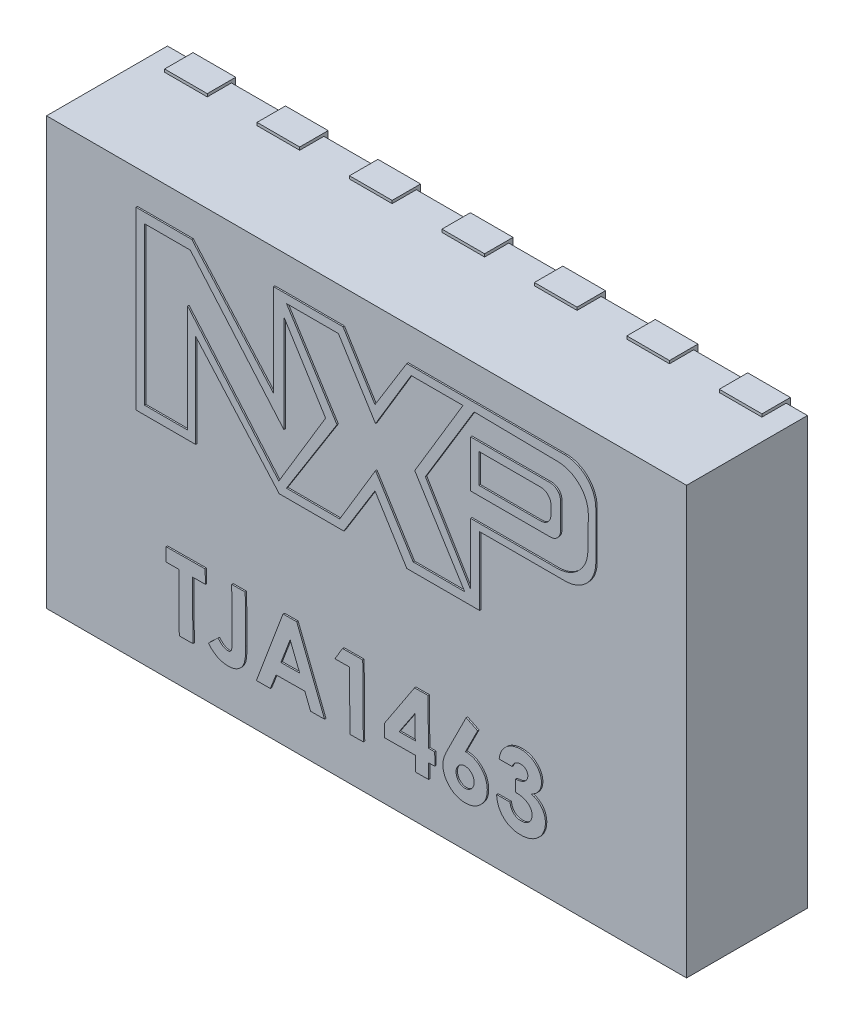
from build123d import *

# Parameters (mm, degrees)
SKETCH1_W           = 4.5
SKETCH1_H           = 3
BOSS_EXTRUDE1_DEPTH = 0.85
SKETCH2_W           = 4.2
SKETCH2_H           = 1.6
SKETCH2_W_2         = 0.3
SKETCH2_H_2         = 0.557287179
BOSS_EXTRUDE2_DEPTH = 0.03
SKETCH3_W           = 5.542428218
SKETCH3_H           = 0.402549931
SKETCH3_W_2         = 5.108551145
SKETCH3_H_2         = 0.537427481
CUT_EXTRUDE1_DEPTH  = 2.03
SKETCH4_W           = 0.3
SKETCH4_H           = 0.2
BOSS_EXTRUDE3_DEPTH = 0.02
BOSS_EXTRUDE4_DEPTH = 0.01
BOSS_EXTRUDE5_DEPTH = 0.01


with BuildPart() as part:
    # Sketch1 → Boss-Extrude1 (new body)
    with BuildSketch(Plane.XY):
        Rectangle(SKETCH1_W, SKETCH1_H)
    extrude(amount=BOSS_EXTRUDE1_DEPTH)

    # Sketch2 → Boss-Extrude2 (add)
    with BuildSketch(Plane(origin=(0, 0, 0), x_dir=(-1, 0, 0), z_dir=(0, 0, -1))):
        Rectangle(SKETCH2_W, SKETCH2_H)
        with Locations((-1.95, 1.37864359)):
            Rectangle(SKETCH2_W_2, SKETCH2_H_2)
        with Locations((-1.3, 1.37864359)):
            Rectangle(SKETCH2_W_2, SKETCH2_H_2)
        with Locations((-0.65, 1.37864359)):
            Rectangle(SKETCH2_W_2, SKETCH2_H_2)
        with Locations((0, 1.37864359)):
            Rectangle(SKETCH2_W_2, SKETCH2_H_2)
        with Locations((0.65, 1.37864359)):
            Rectangle(SKETCH2_W_2, SKETCH2_H_2)
        with Locations((1.3, 1.37864359)):
            Rectangle(SKETCH2_W_2, SKETCH2_H_2)
        with Locations((1.95, 1.37864359)):
            Rectangle(SKETCH2_W_2, SKETCH2_H_2)
        with Locations((1.95, -1.37864359)):
            Rectangle(SKETCH2_W_2, SKETCH2_H_2)
        with Locations((1.3, -1.37864359)):
            Rectangle(SKETCH2_W_2, SKETCH2_H_2)
        with Locations((0.65, -1.37864359)):
            Rectangle(SKETCH2_W_2, SKETCH2_H_2)
        with Locations((0, -1.37864359)):
            Rectangle(SKETCH2_W_2, SKETCH2_H_2)
        with Locations((-0.65, -1.37864359)):
            Rectangle(SKETCH2_W_2, SKETCH2_H_2)
        with Locations((-1.3, -1.37864359)):
            Rectangle(SKETCH2_W_2, SKETCH2_H_2)
        with Locations((-1.95, -1.37864359)):
            Rectangle(SKETCH2_W_2, SKETCH2_H_2)
    extrude(amount=BOSS_EXTRUDE2_DEPTH)

    # Sketch3 → Cut-Extrude1 (cut)
    with BuildSketch(Plane.XY.offset(0.85)):
        with Locations((0.521214109, 1.701274966)):
            Rectangle(SKETCH3_W, SKETCH3_H)
        with Locations((0.304275573, -1.76871374)):
            Rectangle(SKETCH3_W_2, SKETCH3_H_2)
    extrude(amount=-CUT_EXTRUDE1_DEPTH, mode=Mode.SUBTRACT)

    # Sketch4 → Boss-Extrude3 (add)
    with BuildSketch(Plane.XZ.offset(1.5)):
        with Locations((-1.95, 0.07)):
            Rectangle(SKETCH4_W, SKETCH4_H)
        with Locations((-1.3, 0.07)):
            Rectangle(SKETCH4_W, SKETCH4_H)
        with Locations((-0.65, 0.07)):
            Rectangle(SKETCH4_W, SKETCH4_H)
        with Locations((0, 0.07)):
            Rectangle(SKETCH4_W, SKETCH4_H)
        with Locations((0.65, 0.07)):
            Rectangle(SKETCH4_W, SKETCH4_H)
        with Locations((1.3, 0.07)):
            Rectangle(SKETCH4_W, SKETCH4_H)
        with Locations((1.95, 0.07)):
            Rectangle(SKETCH4_W, SKETCH4_H)
    boss_extrude3 = extrude(amount=BOSS_EXTRUDE3_DEPTH)

    # Mirror1: Boss-Extrude3 across plane
    add(boss_extrude3.mirror(Plane.ZX))

    # Sketch8 → Boss-Extrude4 (add)
    # profile 1 of 2: a face of its own
    with BuildSketch(Plane.XY.offset(0.85)):
        with BuildLine():
            Line((-1.218559147, 1.267877009), (-0.644660909, 0.618874845))
            Line((-0.644660909, 0.618874845), (-0.644660909, 1.267877009))
            Line((-0.644660909, 1.267877009), (-0.155544183, 1.267877009))
            Line((-0.155544183, 1.267877009), (0.069183646, 0.905578427))
            Line((0.069183646, 0.905578427), (0.292952543, 1.267877009))
            Line((0.292952543, 1.267877009), (1.405698433, 1.267877009))
            ThreePointArc((1.405698433, 1.267877009), (1.558433498, 1.204612074), (1.621698433, 1.051877009))
            Line((1.621698433, 1.051877009), (1.621698433, 0.716280897))
            ThreePointArc((1.621698433, 0.716280897), (1.558433498, 0.563545832), (1.405698433, 0.500280897))
            Line((1.405698433, 0.500280897), (0.805434822, 0.500280897))
            Line((0.805434822, 0.500280897), (0.805434822, 0.020247185))
            Line((0.805434822, 0.020247185), (0.292952543, 0.020247185))
            Line((0.292952543, 0.020247185), (0.069183646, 0.38099981))
            Line((0.069183646, 0.38099981), (-0.149697341, 0.02661512))
            Line((-0.149697341, 0.02661512), (-0.603870765, 0.02661512))
            Line((-0.603870765, 0.02661512), (-1.192061741, 0.691780461))
            Line((-1.192061741, 0.691780461), (-1.192061741, 0.032897543))
            Line((-1.192061741, 0.032897543), (-1.611137286, 0.032897543))
            Line((-1.611137286, 0.032897543), (-1.611137286, 1.267877009))
            Line((-1.611137286, 1.267877009), (-1.218559147, 1.267877009))
        make_face()
        Polygon((-0.553231932, 1.210312598), (-0.188037013, 1.210312598), (0.073077476, 0.79234991), (0.323648792, 1.210312598), (0.688184293, 1.210312598), (0.348798025, 0.644203119), (0.699760653, 0.08242164), (0.337615575, 0.08242164), (0.073077476, 0.505864459), (-0.178605926, 0.086046767), (-0.553231932, 0.086046767), (-0.198118064, 0.650042618), align=None, mode=Mode.SUBTRACT)
        with BuildLine():
            Line((0.766182701, 1.210312598), (1.356373147, 1.202040737))
            ThreePointArc((1.356373147, 1.202040737), (1.508206605, 1.136641555), (1.569324867, 0.983034882))
            Line((1.569324867, 0.983034882), (1.566236946, 0.762714247))
            ThreePointArc((1.566236946, 0.762714247), (1.501919217, 0.611939743), (1.350258158, 0.549741315))
            Line((1.350258158, 0.549741315), (0.741987684, 0.549741315))
            Line((0.741987684, 0.549741315), (0.741987684, 0.115644305))
            Line((0.741987684, 0.115644305), (0.423296465, 0.644203119))
            Line((0.423296465, 0.644203119), (0.766182701, 1.210312598))
        make_face(mode=Mode.SUBTRACT)
        Polygon((-1.552044791, 0.09243378), (-1.552044791, 1.197500136), (-1.229122452, 1.197500136), (-0.571417002, 0.433439095), (-0.571417002, 1.120265885), (-0.27795521, 0.650042618), (-0.606889936, 0.102651869), (-1.247993344, 0.847426201), (-1.247993344, 0.09243378), align=None, mode=Mode.SUBTRACT)
    # profile 2 of 2: a face of its own
    with BuildSketch(Plane.XY.offset(0.85)):
        with BuildLine():
            Line((0.741987684, 1.046016424), (0.741987684, 0.716280897))
            Line((0.741987684, 0.716280897), (1.301592263, 0.716280897))
            ThreePointArc((1.301592263, 0.716280897), (1.352503951, 0.737369209), (1.373592263, 0.788280897))
            Line((1.373592263, 0.788280897), (1.373592263, 0.974016424))
            ThreePointArc((1.373592263, 0.974016424), (1.352503951, 1.024928112), (1.301592263, 1.046016424))
            Line((1.301592263, 1.046016424), (0.741987684, 1.046016424))
        make_face()
        with BuildLine():
            Line((0.79982972, 0.986259174), (1.234333614, 0.986259174))
            ThreePointArc((1.234333614, 0.986259174), (1.285245302, 0.965170862), (1.306333614, 0.914259174))
            Line((1.306333614, 0.914259174), (1.306333614, 0.851953508))
            ThreePointArc((1.306333614, 0.851953508), (1.285245302, 0.801041819), (1.234333614, 0.779953508))
            Line((1.234333614, 0.779953508), (0.79982972, 0.779953508))
            Line((0.79982972, 0.779953508), (0.79982972, 0.986259174))
        make_face(mode=Mode.SUBTRACT)
    extrude(amount=BOSS_EXTRUDE4_DEPTH)

    # Sketch9 → Boss-Extrude5 (add)
    # profile 1 of 7: a face of its own
    with BuildSketch(Plane.XY.offset(0.85)):
        Polygon((-1.399310853, -0.693693246), (-1.12447111, -0.6912894), (-1.123669828, -0.784638759), (-1.21431486, -0.785440041), (-1.210809251, -1.189386355), (-1.306762776, -1.190287797), (-1.310268385, -0.786341483), (-1.398509571, -0.787042605), align=None)
    # profile 2 of 7: a face of its own
    with BuildSketch(Plane.XY.offset(0.85)):
        with BuildLine():
            Line((-0.938173033, -0.692190842), (-0.843120949, -0.69138956))
            Line((-0.843120949, -0.69138956), (-0.840316462, -1.021317445))
            add(Edge.make_bspline(
                [(-0.840316462, -1.021317445), (-0.840273953, -1.027627977), (-0.840192068, -1.039783978), (-0.840755581, -1.057281917), (-0.841514224, -1.073348022), (-0.842639035, -1.087961486), (-0.844398527, -1.101077384), (-0.846277527, -1.112749454), (-0.848824076, -1.122899753), (-0.852446809, -1.134451439), (-0.858522434, -1.147232389), (-0.867822869, -1.160911403), (-0.879203996, -1.172993591), (-0.892553585, -1.183292732), (-0.90763241, -1.191654606), (-0.924294633, -1.197679182), (-0.942380937, -1.201453536), (-0.954947749, -1.202017177), (-0.961410212, -1.202307028)],
                knots=[0, 0, 0, 0, 1.209486598, 2.329838602, 3.355021681, 4.292484636, 5.137835443, 5.89111849, 6.556963681, 7.141835232, 8.209634135, 9.255089287, 10.300857766, 11.377365432, 12.474428666, 13.591962539, 14.76167063, 16, 16, 16, 16], degree=3))
            add(Edge.make_bspline(
                [(-0.961410212, -1.202307028), (-0.968167571, -1.20213582), (-0.981494318, -1.201798165), (-1.001062768, -1.198476951), (-1.019877812, -1.19306941), (-1.037937777, -1.185275241), (-1.055236031, -1.175151738), (-1.071843008, -1.162854549), (-1.087659356, -1.148271191), (-1.097170126, -1.137171567), (-1.102035212, -1.131493727)],
                knots=[0, 0, 0, 0, 0.993177984, 1.958728763, 2.9098356, 3.866731057, 4.843752359, 5.851453285, 6.900944283, 8, 8, 8, 8], degree=3))
            Line((-1.102035212, -1.131493727), (-1.034326879, -1.066990522))
            add(Edge.make_bspline(
                [(-1.034326879, -1.066990522), (-1.030704174, -1.070945123), (-1.023921627, -1.078349057), (-1.013745732, -1.087952349), (-1.004489419, -1.095539532), (-0.995916998, -1.101113574), (-0.98779128, -1.105065602), (-0.97992251, -1.107630203), (-0.97223842, -1.109387369), (-0.967128511, -1.109569309), (-0.96461534, -1.109658791)],
                knots=[0, 0, 0, 0, 1.527052862, 2.858997954, 3.981709547, 4.931281668, 5.764883684, 6.54670979, 7.285238677, 8, 8, 8, 8], degree=3))
            add(Edge.make_bspline(
                [(-0.96461534, -1.109658791), (-0.962222867, -1.109480914), (-0.957639051, -1.109140113), (-0.951201076, -1.10663254), (-0.945892494, -1.102379402), (-0.942380781, -1.097561474), (-0.94018869, -1.092695302), (-0.938718808, -1.08798944), (-0.937567543, -1.082312072), (-0.936558159, -1.07573021), (-0.935908, -1.068167817), (-0.935418298, -1.059651136), (-0.935095672, -1.050165867), (-0.935143326, -1.043519871), (-0.935168225, -1.040047413)],
                knots=[0, 0, 0, 0, 1.014740194, 1.944172476, 2.883073635, 3.867137759, 4.444472031, 5.143984344, 5.956014201, 6.902485976, 7.970506852, 9.177775936, 10.525419741, 12, 12, 12, 12], degree=3))
            Line((-0.935168225, -1.040047413), (-0.938173033, -0.692190842))
        make_face()
    # profile 3 of 7: a face of its own
    with BuildSketch(Plane.XY.offset(0.85)):
        Polygon((-0.577095308, -0.691990522), (-0.481041622, -0.69118924), (-0.285428642, -1.186782188), (-0.383786013, -1.187683631), (-0.423549635, -1.085520169), (-0.626374154, -1.087323054), (-0.666037616, -1.190087477), (-0.764495148, -1.190988919), align=None)
        Polygon((-0.527315661, -0.823500938), (-0.592019186, -0.994674817), (-0.459907808, -0.993573054), align=None, mode=Mode.SUBTRACT)
    # profile 4 of 7: a face of its own
    with BuildSketch(Plane.XY.offset(0.85)):
        Polygon((-0.158625757, -0.692791804), (-0.016898994, -0.691589881), (-0.012592103, -1.188885554), (-0.106642584, -1.189686836), (-0.110148193, -0.78133347), (-0.212511975, -0.782234913), align=None)
    # profile 5 of 7: a face of its own
    with BuildSketch(Plane.XY.offset(0.85)):
        Polygon((0.347584179, -0.679270169), (0.442235621, -0.678468887), (0.445040108, -0.998681227), (0.489310942, -0.998280586), (0.490012064, -1.08582065), (0.44574123, -1.086221291), (0.446642672, -1.188284592), (0.354094596, -1.189085874), (0.353193153, -1.087022573), (0.136145878, -1.088925618), (0.135444756, -1.001385554), align=None)
        Polygon((0.352492031, -0.999482509), (0.350989628, -0.832815842), (0.238910301, -1.000484111), align=None, mode=Mode.SUBTRACT)
    # profile 6 of 7: a face of its own
    with BuildSketch(Plane.XY.offset(0.85)):
        with BuildLine():
            Line((0.710264467, -0.67957065), (0.790993634, -0.719133951))
            Line((0.790993634, -0.719133951), (0.705657096, -0.888905586))
            add(Edge.make_bspline(
                [(0.705657096, -0.888905586), (0.710838518, -0.889002913), (0.721041701, -0.889194569), (0.736043161, -0.891253127), (0.750463539, -0.894678812), (0.764345482, -0.899431854), (0.777523934, -0.905880989), (0.79025619, -0.913503219), (0.802375614, -0.922635188), (0.813684454, -0.933155403), (0.824212425, -0.944539587), (0.833302127, -0.956909204), (0.841142091, -0.96991547), (0.847392683, -0.983698635), (0.852498906, -0.998120488), (0.856040073, -1.013269937), (0.858328346, -1.029127806), (0.858642049, -1.039939174), (0.858802128, -1.045456067)],
                knots=[0, 0, 0, 0, 1.018137654, 2.004902093, 2.969678775, 3.928700089, 4.882812206, 5.848637716, 6.842384913, 7.859675917, 8.881804503, 9.886074225, 10.872161699, 11.861912345, 12.856244641, 13.875143678, 14.915714941, 16, 16, 16, 16], degree=3))
            add(Edge.make_bspline(
                [(0.858802128, -1.045456067), (0.858706064, -1.050771374), (0.858516841, -1.061241256), (0.856438786, -1.07663394), (0.853091125, -1.091459848), (0.848089281, -1.105608933), (0.841928758, -1.119236749), (0.834091323, -1.13215565), (0.824839842, -1.144444716), (0.814433364, -1.156094661), (0.80293739, -1.166661487), (0.790763355, -1.176000699), (0.777889864, -1.183883776), (0.764495035, -1.190421416), (0.750447684, -1.195463538), (0.735807554, -1.199032117), (0.720593094, -1.201447698), (0.710207021, -1.201752356), (0.704955974, -1.201906387)],
                knots=[0, 0, 0, 0, 1.044161297, 2.056747599, 3.046884618, 4.026461564, 5.00134524, 5.981603371, 6.989586016, 8.021237463, 9.047594761, 10.054294876, 11.032353933, 12.009708241, 12.979098821, 13.959532665, 14.968369424, 16, 16, 16, 16], degree=3))
            add(Edge.make_bspline(
                [(0.704955974, -1.201906387), (0.69944102, -1.201810032), (0.688639592, -1.201621313), (0.672765283, -1.199572225), (0.657587948, -1.196086315), (0.643072982, -1.191061216), (0.629301491, -1.184492183), (0.616179498, -1.176550387), (0.603836602, -1.167061667), (0.59230991, -1.156290681), (0.581781349, -1.144594032), (0.572551359, -1.132244611), (0.564644984, -1.119514545), (0.558352715, -1.106230274), (0.553145619, -1.092640683), (0.549586956, -1.078517196), (0.54728771, -1.063993757), (0.546965812, -1.054145367), (0.546802929, -1.049161996)],
                knots=[0, 0, 0, 0, 1.083045268, 2.121221099, 3.13797642, 4.137876037, 5.13255511, 6.130408597, 7.14587237, 8.185518485, 9.225992015, 10.233543626, 11.211184445, 12.164694915, 13.117460517, 14.065676557, 15.021215536, 16, 16, 16, 16], degree=3))
            add(Edge.make_bspline(
                [(0.546802929, -1.049161996), (0.546841765, -1.045319736), (0.546919972, -1.037582449), (0.548163637, -1.025958919), (0.550316032, -1.014330893), (0.552687604, -1.004497578), (0.555384533, -0.996276354), (0.557909246, -0.989271143), (0.560870577, -0.981409703), (0.564683201, -0.972881107), (0.568672811, -0.96340132), (0.573615534, -0.953309392), (0.578840388, -0.942318639), (0.582613463, -0.934772496), (0.584563346, -0.930872733)],
                knots=[0, 0, 0, 0, 1.101863569, 2.218859815, 3.347986803, 4.493248451, 5.117227413, 5.829175619, 6.629625924, 7.526348739, 8.508612668, 9.579698087, 10.749215026, 12, 12, 12, 12], degree=3))
            Line((0.584563346, -0.930872733), (0.710264467, -0.67957065))
        make_face()
        with BuildLine():
            add(Edge.make_bspline(
                [(0.701049724, -0.978549015), (0.696782772, -0.978804739), (0.688488198, -0.979301843), (0.676587966, -0.983052588), (0.665922789, -0.989323717), (0.656539802, -0.997746425), (0.648826037, -1.007941571), (0.643234858, -1.019541929), (0.639923472, -1.0323866), (0.639612222, -1.041329423), (0.639451166, -1.045956868)],
                knots=[0, 0, 0, 0, 1.003811643, 1.951320622, 2.906142115, 3.897371915, 4.902260824, 5.897505543, 6.912068843, 8, 8, 8, 8], degree=3))
            add(Edge.make_bspline(
                [(0.639451166, -1.045956868), (0.639704704, -1.050590486), (0.640197934, -1.059604698), (0.643959057, -1.072498834), (0.649930544, -1.084232226), (0.658166974, -1.09444572), (0.667829549, -1.102950382), (0.678673067, -1.109087067), (0.690311378, -1.112921375), (0.69838334, -1.113282738), (0.702451967, -1.113464881)],
                knots=[0, 0, 0, 0, 1.083811192, 2.108439807, 3.119070023, 4.14849075, 5.162834589, 6.115223768, 7.049988985, 8, 8, 8, 8], degree=3))
            add(Edge.make_bspline(
                [(0.702451967, -1.113464881), (0.706725206, -1.113225762), (0.715116123, -1.112756231), (0.727086186, -1.10868428), (0.738122405, -1.102506807), (0.747839204, -1.093942539), (0.7560893, -1.083709723), (0.762110303, -1.071897234), (0.765596337, -1.058740706), (0.765964016, -1.049583831), (0.76615389, -1.044855105)],
                knots=[0, 0, 0, 0, 0.981926849, 1.928108441, 2.88213558, 3.879930144, 4.892555615, 5.893546729, 6.912200913, 8, 8, 8, 8], degree=3))
            add(Edge.make_bspline(
                [(0.76615389, -1.044855105), (0.765896402, -1.04025561), (0.765393725, -1.031276324), (0.761688941, -1.018510116), (0.75575352, -1.006925339), (0.747518773, -0.996973467), (0.737804962, -0.988521271), (0.726490718, -0.982680299), (0.71413894, -0.978953667), (0.705484464, -0.978686115), (0.701049724, -0.978549015)],
                knots=[0, 0, 0, 0, 1.062668883, 2.074577623, 3.048532191, 4.053136985, 5.044837952, 6.005104562, 6.977772572, 8, 8, 8, 8], degree=3))
        make_face(mode=Mode.SUBTRACT)
    # profile 7 of 7: a face of its own
    with BuildSketch(Plane.XY.offset(0.85)):
        with BuildLine():
            Line((1.033181134, -0.815387958), (0.942235621, -0.816089079))
            add(Edge.make_bspline(
                [(0.942235621, -0.816089079), (0.942828484, -0.811601939), (0.943995656, -0.802768094), (0.946997844, -0.78998131), (0.950511523, -0.777777247), (0.95508112, -0.766361763), (0.960296177, -0.755560166), (0.966291683, -0.745391342), (0.973239374, -0.73595286), (0.978414001, -0.73014616), (0.98099764, -0.727246932)],
                knots=[0, 0, 0, 0, 1.100540977, 2.166638191, 3.192102334, 4.187660448, 5.154026013, 6.10829865, 7.055492222, 8, 8, 8, 8], degree=3))
            add(Edge.make_bspline(
                [(0.98099764, -0.727246932), (0.984799095, -0.723495465), (0.992310844, -0.716082494), (1.004706966, -0.706447902), (1.017833823, -0.698266396), (1.031712793, -0.69149293), (1.046389481, -0.686338452), (1.061733193, -0.682472201), (1.077850307, -0.680157083), (1.088862843, -0.679768716), (1.094479211, -0.67957065)],
                knots=[0, 0, 0, 0, 1.011776976, 1.999290932, 2.968710122, 3.939615709, 4.920515979, 5.912138565, 6.935195367, 8, 8, 8, 8], degree=3))
            add(Edge.make_bspline(
                [(1.094479211, -0.67957065), (1.09949232, -0.679647089), (1.109315575, -0.679796872), (1.123762154, -0.681560724), (1.137609209, -0.68444756), (1.150894538, -0.688518786), (1.163486453, -0.693994537), (1.1754749, -0.700664166), (1.186917819, -0.708458905), (1.197572302, -0.71746915), (1.207275833, -0.727271557), (1.215885725, -0.737623414), (1.223115363, -0.748478998), (1.229094746, -0.759772999), (1.233744047, -0.771564695), (1.236988371, -0.783840373), (1.239238071, -0.796543221), (1.239485872, -0.805195101), (1.239611422, -0.809578663)],
                knots=[0, 0, 0, 0, 1.109786789, 2.174642061, 3.217367451, 4.239437523, 5.24630828, 6.252527165, 7.273928299, 8.307806609, 9.337870051, 10.325357381, 11.285158667, 12.221224017, 13.150841753, 14.085387137, 15.029942259, 16, 16, 16, 16], degree=3))
            add(Edge.make_bspline(
                [(1.239611422, -0.809578663), (1.239438094, -0.815003299), (1.23909575, -0.825717562), (1.235780634, -0.841429591), (1.230224722, -0.856424867), (1.222332405, -0.87055733), (1.212434292, -0.883788307), (1.200134707, -0.895550494), (1.186028012, -0.906304742), (1.175364651, -0.912018872), (1.169899884, -0.914947252)],
                knots=[0, 0, 0, 0, 0.973922818, 1.923606288, 2.871012245, 3.837903975, 4.823184128, 5.828845621, 6.887325342, 8, 8, 8, 8], degree=3))
            add(Edge.make_bspline(
                [(1.169899884, -0.914947252), (1.173589545, -0.916099197), (1.180854727, -0.918367452), (1.191317914, -0.922587015), (1.201144044, -0.927513048), (1.210389576, -0.933030083), (1.219062149, -0.939152906), (1.227076133, -0.945955759), (1.234414685, -0.953455052), (1.241215462, -0.961424097), (1.24734509, -0.969895574), (1.252546027, -0.978899583), (1.257056291, -0.988195347), (1.260850192, -0.99788105), (1.263559802, -1.00801594), (1.265712047, -1.018475344), (1.267032922, -1.029330672), (1.267247106, -1.03670518), (1.267355814, -1.040448054)],
                knots=[0, 0, 0, 0, 1.083129036, 2.132751095, 3.158104814, 4.161180593, 5.147883554, 6.130450683, 7.103209139, 8.085776268, 9.064861164, 10.029483021, 10.996326624, 11.95913101, 12.939958567, 13.932855026, 14.950836938, 16, 16, 16, 16], degree=3))
            add(Edge.make_bspline(
                [(1.267355814, -1.040448054), (1.267275996, -1.045931752), (1.267118592, -1.056745928), (1.26479959, -1.072644322), (1.261164808, -1.087946949), (1.255772275, -1.102562876), (1.248928457, -1.116558775), (1.240558929, -1.129966153), (1.230599619, -1.142731262), (1.21910048, -1.154646221), (1.206516481, -1.16561763), (1.192897332, -1.175173739), (1.178485861, -1.183348678), (1.1631988, -1.190104089), (1.146967646, -1.195287094), (1.12991057, -1.199095486), (1.112003101, -1.201419636), (1.099794525, -1.201808522), (1.093577769, -1.202006547)],
                knots=[0, 0, 0, 0, 0.992410003, 1.957090855, 2.90311111, 3.836699189, 4.772458702, 5.720506208, 6.694280015, 7.699377008, 8.715402436, 9.713654193, 10.707500257, 11.712014944, 12.735142019, 13.788541852, 14.873898364, 16, 16, 16, 16], degree=3))
            add(Edge.make_bspline(
                [(1.093577769, -1.202006547), (1.087696408, -1.20194279), (1.076134317, -1.201817451), (1.059205521, -1.199872113), (1.04309603, -1.196613304), (1.027861312, -1.191829734), (1.01336897, -1.185845408), (0.999683098, -1.17842043), (0.986920178, -1.169511172), (0.974991744, -1.159437584), (0.964152268, -1.148084534), (0.954543674, -1.135649988), (0.946159269, -1.122242275), (0.939138049, -1.107834228), (0.933389101, -1.092406098), (0.929077253, -1.075949812), (0.925769705, -1.058550518), (0.924735461, -1.046571506), (0.924206775, -1.040448054)],
                knots=[0, 0, 0, 0, 1.078875807, 2.120947897, 3.12198403, 4.091021229, 5.046911852, 5.995626787, 6.942380686, 7.898781798, 8.856575552, 9.817480718, 10.778112328, 11.753694867, 12.754149466, 13.794598922, 14.872639174, 16, 16, 16, 16], degree=3))
            Line((0.924206775, -1.040448054), (1.017856615, -1.039646772))
            add(Edge.make_bspline(
                [(1.017856615, -1.039646772), (1.018410943, -1.042761932), (1.019491878, -1.048836469), (1.021850319, -1.05754886), (1.024488284, -1.06568513), (1.027718305, -1.073156872), (1.031433119, -1.079979305), (1.035551833, -1.086212689), (1.040034149, -1.091891696), (1.04676642, -1.098405601), (1.056155884, -1.10525527), (1.068948873, -1.110998617), (1.083035719, -1.114549514), (1.092888003, -1.114824848), (1.09798482, -1.114967284)],
                knots=[0, 0, 0, 0, 0.936050198, 1.825290612, 2.669002309, 3.46568794, 4.230672103, 4.965179962, 5.675080059, 6.366867474, 7.732720052, 9.090290205, 10.494739261, 12, 12, 12, 12], degree=3))
            add(Edge.make_bspline(
                [(1.09798482, -1.114967284), (1.100693781, -1.114889786), (1.106000906, -1.114737959), (1.1137654, -1.113559809), (1.121199287, -1.11192191), (1.128228054, -1.109478117), (1.134917841, -1.106459002), (1.141250208, -1.102758045), (1.14716501, -1.098285169), (1.152748795, -1.093316545), (1.157835146, -1.087890344), (1.162156512, -1.081993833), (1.165868912, -1.075907586), (1.168953161, -1.069517726), (1.171179781, -1.062799238), (1.172985487, -1.05582323), (1.173819464, -1.048514888), (1.173943704, -1.04355441), (1.174006455, -1.041049015)],
                knots=[0, 0, 0, 0, 1.097889058, 2.150874152, 3.178758355, 4.180547348, 5.162006466, 6.151091933, 7.147469529, 8.16378849, 9.17920542, 10.156641573, 11.122477657, 12.067113507, 13.026094201, 13.988127767, 14.983861381, 16, 16, 16, 16], degree=3))
            add(Edge.make_bspline(
                [(1.174006455, -1.041049015), (1.173919764, -1.038269163), (1.17374924, -1.032801028), (1.17211227, -1.024829201), (1.169897946, -1.017145867), (1.166496858, -1.009881287), (1.162263216, -1.002931207), (1.15711221, -0.99625799), (1.150980744, -0.990003719), (1.144050863, -0.9840469), (1.136247208, -0.978646627), (1.127577715, -0.973934959), (1.118113622, -0.969927513), (1.107851307, -0.966643971), (1.096807607, -0.964011389), (1.084902949, -0.962305334), (1.072237757, -0.961021326), (1.063499869, -0.96088864), (1.05902248, -0.96082065)],
                knots=[0, 0, 0, 0, 0.852230196, 1.67638744, 2.490219465, 3.301983627, 4.129892406, 4.984768617, 5.883552757, 6.814035955, 7.786365506, 8.790844628, 9.837874966, 10.936650381, 12.095133425, 13.318535417, 14.625988286, 16, 16, 16, 16], degree=3))
            Line((1.05902248, -0.96082065), (1.058321358, -0.879690842))
            add(Edge.make_bspline(
                [(1.058321358, -0.879690842), (1.063671446, -0.879156223), (1.073643155, -0.878159778), (1.087484867, -0.875796613), (1.099145987, -0.872779033), (1.108872261, -0.869021251), (1.117023984, -0.864521569), (1.123946274, -0.859235896), (1.130100112, -0.853425804), (1.135069858, -0.846768492), (1.139040604, -0.839714971), (1.142044918, -0.832406434), (1.143811348, -0.8248211), (1.143976049, -0.819670381), (1.144058538, -0.817090682)],
                knots=[0, 0, 0, 0, 1.640939145, 3.058448181, 4.282159335, 5.311710592, 6.233302108, 7.11385688, 7.964350089, 8.808222665, 9.638758182, 10.429837435, 11.213595692, 12, 12, 12, 12], degree=3))
            add(Edge.make_bspline(
                [(1.144058538, -0.817090682), (1.143856243, -0.81383226), (1.143462991, -0.807498037), (1.140674098, -0.79845973), (1.136061735, -0.790353461), (1.129671576, -0.783378186), (1.122011137, -0.777528581), (1.113026081, -0.773372589), (1.103004689, -0.770782947), (1.095931419, -0.770607065), (1.092275685, -0.770516163)],
                knots=[0, 0, 0, 0, 1.001987558, 1.947818481, 2.88202438, 3.849705422, 4.840247374, 5.828494982, 6.877684071, 8, 8, 8, 8], degree=3))
            add(Edge.make_bspline(
                [(1.092275685, -0.770516163), (1.088954481, -0.770703715), (1.082392014, -0.771074306), (1.07283201, -0.773613187), (1.063717304, -0.777492958), (1.055366343, -0.783055445), (1.04786973, -0.789729709), (1.04151221, -0.797363793), (1.036429568, -0.805941445), (1.034276315, -0.812203148), (1.033181134, -0.815387958)],
                knots=[0, 0, 0, 0, 1.003991021, 1.983815676, 2.974459443, 3.988509074, 5.004217087, 6.001224359, 6.983388555, 8, 8, 8, 8], degree=3))
        make_face()
    extrude(amount=BOSS_EXTRUDE5_DEPTH)


solid = part.part
